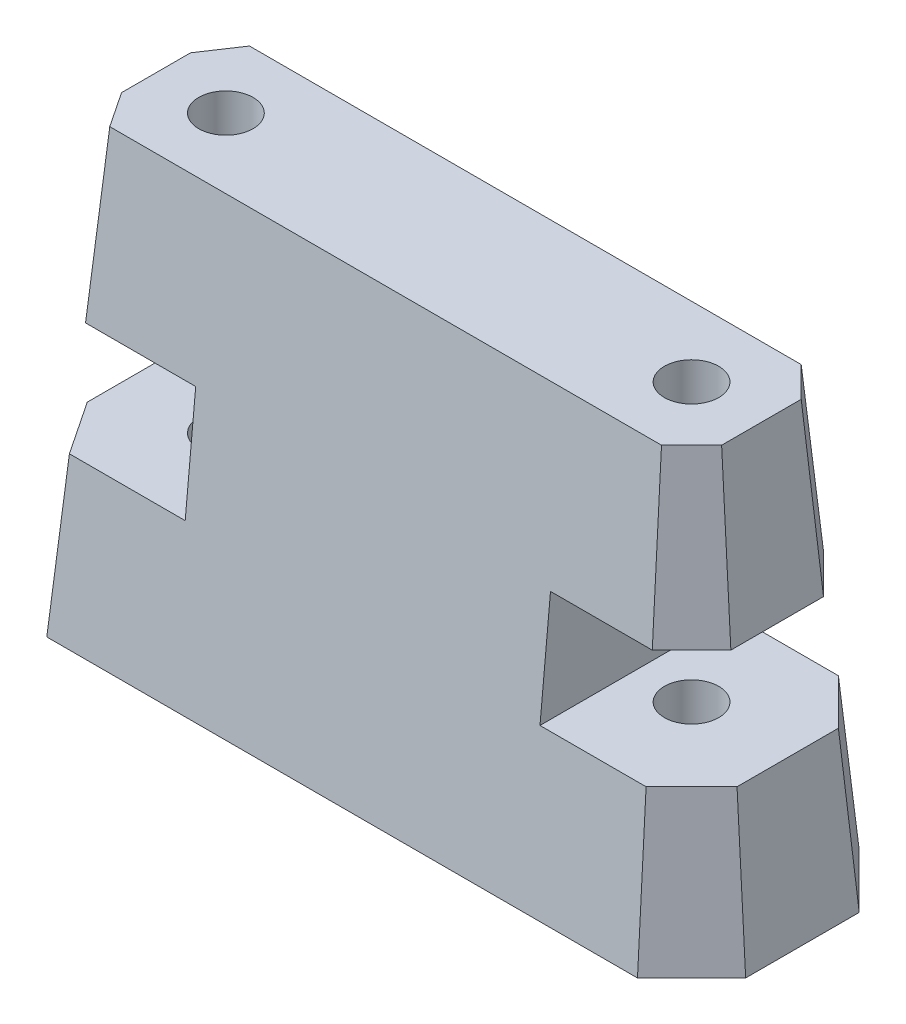
from build123d import *

# Parameters (mm, degrees)
CUT_EXTRUDE1_DEPTH = 51.813384221
SKETCH3_W          = 20.914953444
SKETCH3_H          = 10
CUT_EXTRUDE2_DEPTH = 51.813384221


with BuildPart() as part:
    # Sketch1 → Loft1 section 0
    with BuildSketch(Plane(origin=(0, 0, 0), x_dir=(1, 0, 0), z_dir=(0, 1, 0))):
        with BuildLine():
            Line((-25.17448832, 6.3), (-27.3, 3.111028865))
            Line((-27.3, 3.111028865), (-27.3, -3.111028865))
            Line((-27.3, -3.111028865), (-25.17448832, -6.3))
            Line((-25.17448832, -6.3), (-13.695486873, -6.3))
            Line((-13.695486873, -6.3), (13.695486873, -6.3))
            Line((13.695486873, -6.3), (24.588730163, -6.3))
            Line((24.588730163, -6.3), (27.3, -3.588730163))
            Line((27.3, -3.588730163), (27.3, 3.588730163))
            Line((27.3, 3.588730163), (24.588730163, 6.3))
            Line((24.588730163, 6.3), (13.695486873, 6.3))
            Line((13.695486873, 6.3), (-13.695486873, 6.3))
            Line((-13.695486873, 6.3), (-25.17448832, 6.3))
        make_face()
    # Sketch2 → Loft1 section 1
    with BuildSketch(Plane(origin=(0, -39, 0), x_dir=(1, 0, 0), z_dir=(0, 1, 0))):
        with BuildLine():
            Line((26.121320344, 10), (13.695486873, 10))
            Line((13.695486873, 10), (-13.695486873, 10))
            Line((-13.695486873, 10), (-27.154910603, 10))
            Line((-27.154910603, 10), (-31, 4.231093051))
            Line((-31, 4.231093051), (-31, -4.231093051))
            Line((-31, -4.231093051), (-27.154910603, -10))
            Line((-27.154910603, -10), (-13.695486873, -10))
            Line((-13.695486873, -10), (13.695486873, -10))
            Line((13.695486873, -10), (26.121320344, -10))
            Line((26.121320344, -10), (31, -5.121320344))
            Line((31, -5.121320344), (31, 5.121320344))
            Line((31, 5.121320344), (26.121320344, 10))
        make_face()
    loft()

    # Sketch1<4> → Cut-Extrude1 (cut, through all)
    with BuildSketch(Plane(origin=(0, 0, 0), x_dir=(1, 0, 0), z_dir=(0, 1, 0))):
        with BuildLine():
            ThreePointArc((21, 2.45), (18.55, 0), (21, -2.45))
            ThreePointArc((21, -2.45), (23.45, 0), (21, 2.45))
        make_face()
        with BuildLine():
            ThreePointArc((-21, -2.45), (-18.55, 0), (-21, 2.45))
            ThreePointArc((-21, 2.45), (-23.45, 0), (-21, -2.45))
        make_face()
    extrude(amount=-CUT_EXTRUDE1_DEPTH, mode=Mode.SUBTRACT)

    # Sketch3 → Cut-Extrude2 (cut, symmetric)
    with BuildSketch(Plane.XY):
        with Locations((-26.457476722, -20)):
            Rectangle(SKETCH3_W, SKETCH3_H)
    cut_extrude2 = extrude(amount=CUT_EXTRUDE2_DEPTH, both=True, mode=Mode.SUBTRACT)

    # Mirror1: Cut-Extrude2 across plane
    add(cut_extrude2.mirror(Plane(origin=(0, 0, 0), x_dir=(0, 0, 1), z_dir=(1, 0, 0))), mode=Mode.SUBTRACT)


solid = part.part
